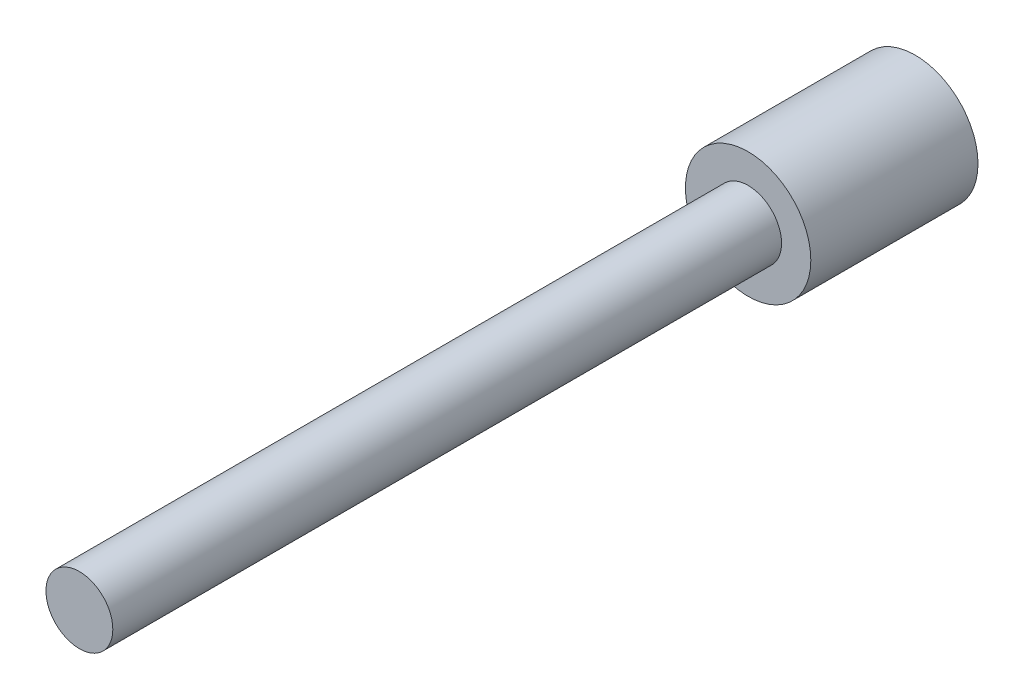
from build123d import *

# Parameters (mm, degrees)
ESBO_O1_R                = 7.5
RESSALTO_EXTRUS_O1_DEPTH = 20
ESBO_O2_R                = 4
RESSALTO_EXTRUS_O2_DEPTH = 80


with BuildPart() as part:
    # Esboço1 → Ressalto-extrusão1 (new body)
    with BuildSketch(Plane.XY):
        Circle(ESBO_O1_R)
    extrude(amount=RESSALTO_EXTRUS_O1_DEPTH)

    # Esboço2 → Ressalto-extrusão2 (add)
    with BuildSketch(Plane.XY.offset(20)):
        Circle(ESBO_O2_R)
    extrude(amount=RESSALTO_EXTRUS_O2_DEPTH)


solid = part.part
